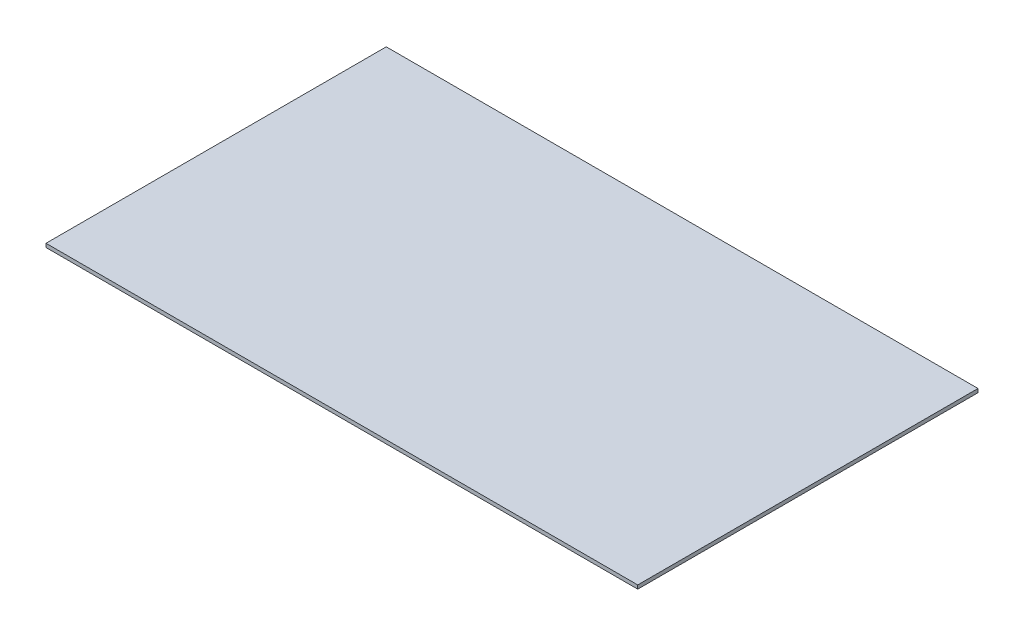
from build123d import *

# Parameters (mm, degrees)
SKETCH2_W           = 508
SKETCH2_H           = 292.1
BOSS_EXTRUDE1_DEPTH = 3.175


with BuildPart() as part:
    # Sketch2 → Boss-Extrude1 (new body)
    with BuildSketch(Plane(origin=(0, 0, 0), x_dir=(1, 0, 0), z_dir=(0, 1, 0))):
        Rectangle(SKETCH2_W, SKETCH2_H)
    extrude(amount=BOSS_EXTRUDE1_DEPTH)


solid = part.part
